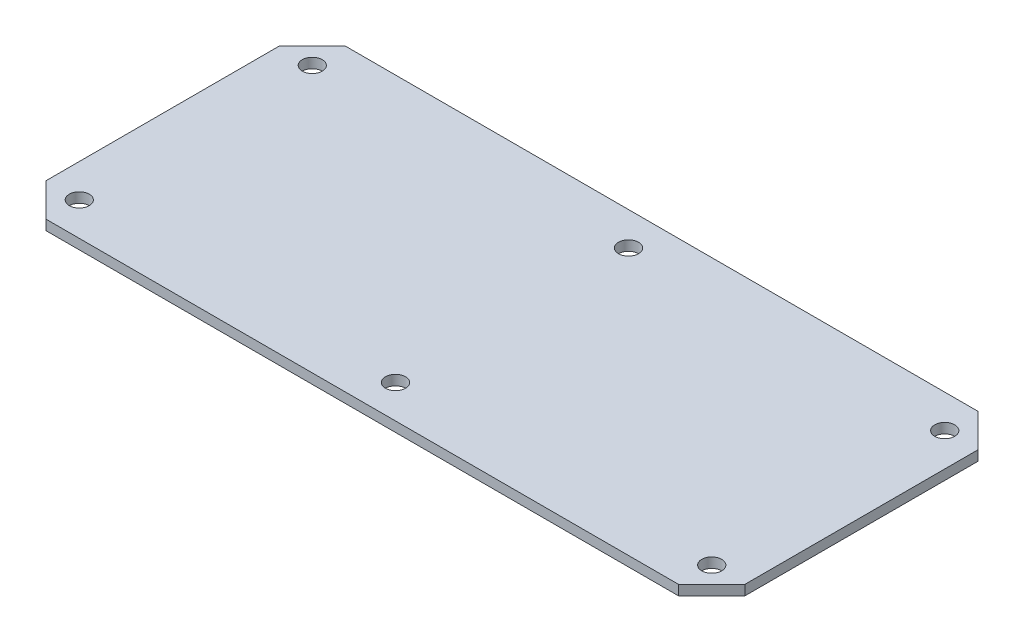
from build123d import *

# Parameters (mm, degrees)
ESQUISSE1_W             = 210
ESQUISSE1_H             = 90
BOSS_EXTRU_1_DEPTH      = 3
ESQUISSE2_R             = 3
ENL_V_MAT_EXTRU_1_DEPTH = 3
CHAMFER1_SIZE           = 10


with BuildPart() as part:
    # Esquisse1 → Boss.-Extru.1 (new body)
    with BuildSketch(Plane(origin=(0, 0, 0), x_dir=(1, 0, 0), z_dir=(0, 1, 0))):
        with Locations((105, 45)):
            Rectangle(ESQUISSE1_W, ESQUISSE1_H)
    extrude(amount=BOSS_EXTRU_1_DEPTH)

    # Esquisse2 → Enlèv. mat.-Extru.1 (cut)
    with BuildSketch(Plane(origin=(0, 3, 0), x_dir=(1, 0, 0), z_dir=(0, 1, 0))):
        with Locations(Location((10, 80, 0), (0, 0, 270))):
            Circle(ESQUISSE2_R)
        with Locations(Location((105, 80, 0), (0, 0, 270))):
            Circle(ESQUISSE2_R)
        with Locations(Location((200, 80, 0), (0, 0, 270))):
            Circle(ESQUISSE2_R)
        with Locations(Location((200, 10, 0), (0, 0, 270))):
            Circle(ESQUISSE2_R)
        with Locations(Location((105, 10, 0), (0, 0, 270))):
            Circle(ESQUISSE2_R)
        with Locations(Location((10, 10, 0), (0, 0, 270))):
            Circle(ESQUISSE2_R)
    extrude(amount=-ENL_V_MAT_EXTRU_1_DEPTH, mode=Mode.SUBTRACT)

    # Chamfer1
    chamfer1_edges = [part.edges().sort_by_distance(p)[0] for p in [
        (210, 1.5, 0),
        (0, 1.5, 0),
        (0, 1.5, -90),
        (210, 1.5, -90),
    ]]
    chamfer(chamfer1_edges, length=CHAMFER1_SIZE)


solid = part.part
